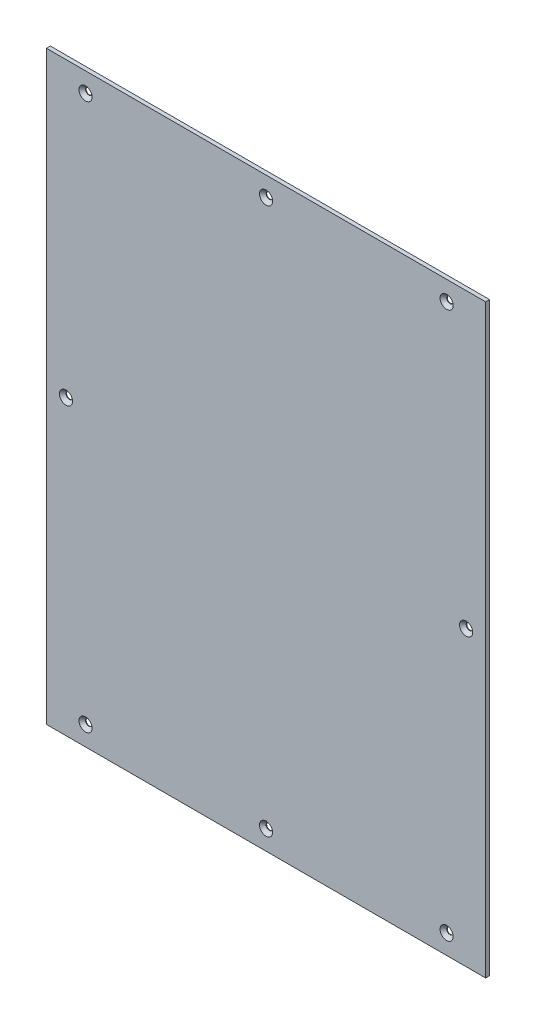
from build123d import *

# Parameters (mm, degrees)
SKETCH1_W                                    = 450
SKETCH1_H                                    = 600
BOSS_EXTRUDE1_DEPTH                          = 4
CSK_FOR_M6_HEX_SOCKET_COUNTERSUNK_CA_2_COUNT = 2
CSK_FOR_M6_HEX_SOCKET_COUNTERSUNK_CA_2_PITCH = 410
CSK_FOR_M6_HEX_SOCKET_COUNTERSUNK_CA_3_COUNT = 2
CSK_FOR_M6_HEX_SOCKET_COUNTERSUNK_CA_3_PITCH = 280.713376952
CSK_FOR_M6_HEX_SOCKET_COUNTERSUNK_CA_4_COUNT = 2
CSK_FOR_M6_HEX_SOCKET_COUNTERSUNK_CA_4_PITCH = 347.023053989
CSK_FOR_M6_HEX_SOCKET_COUNTERSUNK_CA_5_COUNT = 2
CSK_FOR_M6_HEX_SOCKET_COUNTERSUNK_CA_5_PITCH = 480.104155366
CSK_FOR_M6_HEX_SOCKET_COUNTERSUNK_CA_6_COUNT = 2
CSK_FOR_M6_HEX_SOCKET_COUNTERSUNK_CA_6_PITCH = 480.104155366
CSK_FOR_M6_HEX_SOCKET_COUNTERSUNK_CA_7_COUNT = 2
CSK_FOR_M6_HEX_SOCKET_COUNTERSUNK_CA_7_PITCH = 347.023053989
CSK_FOR_M6_HEX_SOCKET_COUNTERSUNK_CA_8_COUNT = 2
CSK_FOR_M6_HEX_SOCKET_COUNTERSUNK_CA_8_PITCH = 280.713376952


with BuildPart() as part:
    # Sketch1 → Boss-Extrude1 (new body)
    with BuildSketch(Plane.XY):
        Rectangle(SKETCH1_W, SKETCH1_H)
    extrude(amount=BOSS_EXTRUDE1_DEPTH)

    # Sketch4 → CSK for M6 Hex Socket Countersunk Cap Screw1 (revolve, cut)
    with BuildSketch(Plane(origin=(-205, 0, 4), x_dir=(0, -1, 0), z_dir=(1, 0, 0))):
        Polygon((0, 0), (0, 4), (3.3, 4), (3.3, 3.42), (6.72, 0), align=None)
    csk_for_m6_hex_socket_countersunk_cap_sc = revolve(axis=Axis((-205, 0, 10.35), (0, 0, -1)), mode=Mode.SUBTRACT)

    # CSK for M6 Hex Socket Countersunk Ca 2: CSK for M6 Hex Socket Countersunk Cap Screw1 ×2
    with Locations(*[(i * CSK_FOR_M6_HEX_SOCKET_COUNTERSUNK_CA_2_PITCH, 0, 0) for i in range(1, CSK_FOR_M6_HEX_SOCKET_COUNTERSUNK_CA_2_COUNT)]):
        add(csk_for_m6_hex_socket_countersunk_cap_sc, mode=Mode.SUBTRACT)

    # CSK for M6 Hex Socket Countersunk Ca 3: CSK for M6 Hex Socket Countersunk Cap Screw1 ×2
    with Locations(*[Vector(0.07124704998790944, -0.997458699830735, 0) * (i * CSK_FOR_M6_HEX_SOCKET_COUNTERSUNK_CA_3_PITCH) for i in range(1, CSK_FOR_M6_HEX_SOCKET_COUNTERSUNK_CA_3_COUNT)]):
        add(csk_for_m6_hex_socket_countersunk_cap_sc, mode=Mode.SUBTRACT)

    # CSK for M6 Hex Socket Countersunk Ca 4: CSK for M6 Hex Socket Countersunk Cap Screw1 ×2
    with Locations(*[Vector(0.5907388504694923, -0.8068628201534528, 0) * (i * CSK_FOR_M6_HEX_SOCKET_COUNTERSUNK_CA_4_PITCH) for i in range(1, CSK_FOR_M6_HEX_SOCKET_COUNTERSUNK_CA_4_COUNT)]):
        add(csk_for_m6_hex_socket_countersunk_cap_sc, mode=Mode.SUBTRACT)

    # CSK for M6 Hex Socket Countersunk Ca 5: CSK for M6 Hex Socket Countersunk Cap Screw1 ×2
    with Locations(*[Vector(0.812323733591591, -0.5832067830913987, 0) * (i * CSK_FOR_M6_HEX_SOCKET_COUNTERSUNK_CA_5_PITCH) for i in range(1, CSK_FOR_M6_HEX_SOCKET_COUNTERSUNK_CA_5_COUNT)]):
        add(csk_for_m6_hex_socket_countersunk_cap_sc, mode=Mode.SUBTRACT)

    # CSK for M6 Hex Socket Countersunk Ca 6: CSK for M6 Hex Socket Countersunk Cap Screw1 ×2
    with Locations(*[Vector(0.8123237335915912, 0.5832067830913987, 0) * (i * CSK_FOR_M6_HEX_SOCKET_COUNTERSUNK_CA_6_PITCH) for i in range(1, CSK_FOR_M6_HEX_SOCKET_COUNTERSUNK_CA_6_COUNT)]):
        add(csk_for_m6_hex_socket_countersunk_cap_sc, mode=Mode.SUBTRACT)

    # CSK for M6 Hex Socket Countersunk Ca 7: CSK for M6 Hex Socket Countersunk Cap Screw1 ×2
    with Locations(*[Vector(0.5907388504694924, 0.8068628201534526, 0) * (i * CSK_FOR_M6_HEX_SOCKET_COUNTERSUNK_CA_7_PITCH) for i in range(1, CSK_FOR_M6_HEX_SOCKET_COUNTERSUNK_CA_7_COUNT)]):
        add(csk_for_m6_hex_socket_countersunk_cap_sc, mode=Mode.SUBTRACT)

    # CSK for M6 Hex Socket Countersunk Ca 8: CSK for M6 Hex Socket Countersunk Cap Screw1 ×2
    with Locations(*[Vector(0.07124704998790946, 0.997458699830735, 0) * (i * CSK_FOR_M6_HEX_SOCKET_COUNTERSUNK_CA_8_PITCH) for i in range(1, CSK_FOR_M6_HEX_SOCKET_COUNTERSUNK_CA_8_COUNT)]):
        add(csk_for_m6_hex_socket_countersunk_cap_sc, mode=Mode.SUBTRACT)


solid = part.part
